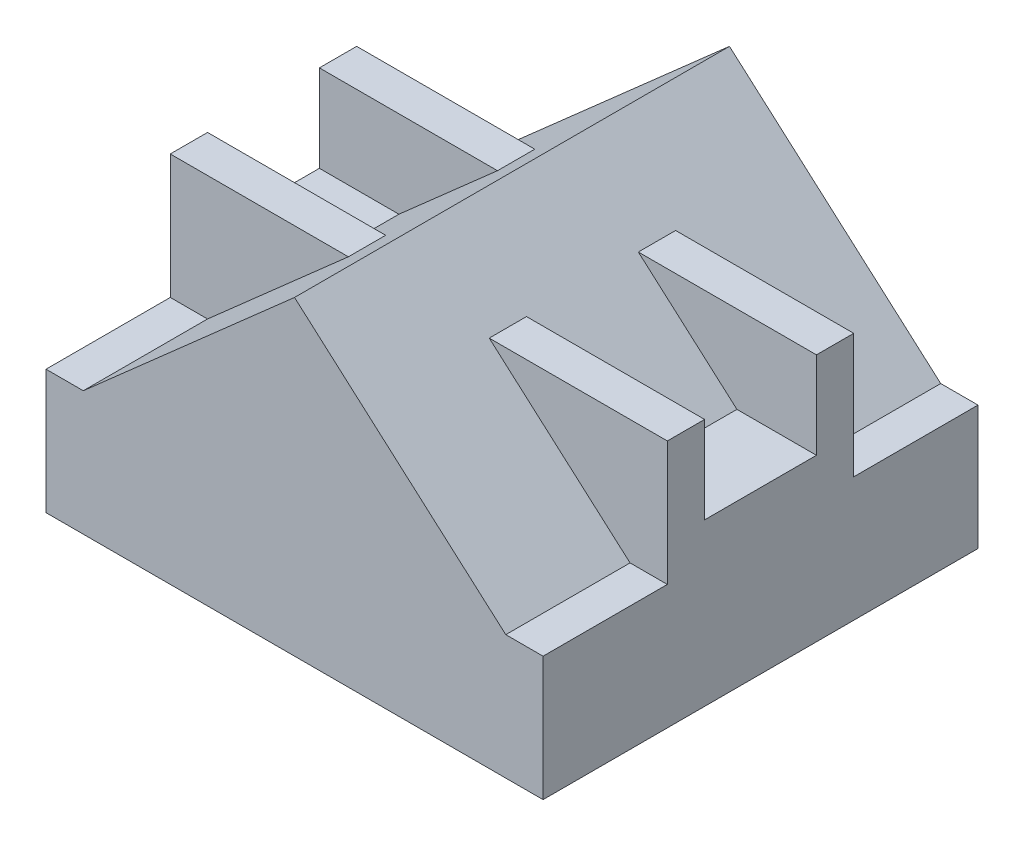
from build123d import *

# Parameters (mm, degrees)
SKETCH1_W           = 30
SKETCH1_H           = 45
SKETCH1_W_2         = 15
SKETCH1_H_2         = 50
BOSS_EXTRUDE3_DEPTH = 50
BOSS_EXTRUDE4_DEPTH = 175
BOSS_EXTRUDE6_DEPTH = 100


with BuildPart() as part:
    # Sketch1 → Boss-Extrude3 (new body)
    with BuildSketch(Plane(origin=(0, 0, 0), x_dir=(1, 0, 0), z_dir=(0, 1, 0))):
        Polygon((85, 87.5), (-85, 87.5), (-85, 37.5), (-70, 37.5), (-35, 37.5), (-35, 22.5), (-70, 22.5), (-70, -22.5), (-35, -22.5), (-35, -37.5), (-85, -37.5), (-85, -87.5), (85, -87.5), (85, -37.5), (35, -37.5), (35, -22.5), (70, -22.5), (70, 22.5), (35, 22.5), (35, 37.5), (70, 37.5), (85, 37.5), align=None)
        with Locations((-85, 0)):
            Rectangle(SKETCH1_W, SKETCH1_H)
        with Locations((-92.5, 62.5)):
            Rectangle(SKETCH1_W_2, SKETCH1_H_2)
        Polygon((-85, 37.5), (-100, 37.5), (-100, 22.5), (-70, 22.5), (-35, 22.5), (-35, 37.5), (-70, 37.5), align=None)
        Polygon((-70, -22.5), (-100, -22.5), (-100, -37.5), (-85, -37.5), (-35, -37.5), (-35, -22.5), align=None)
        with Locations((-92.5, -62.5)):
            Rectangle(SKETCH1_W_2, SKETCH1_H_2)
        with Locations((92.5, 62.5)):
            Rectangle(SKETCH1_W_2, SKETCH1_H_2)
        Polygon((100, 37.5), (85, 37.5), (70, 37.5), (35, 37.5), (35, 22.5), (70, 22.5), (100, 22.5), align=None)
        with Locations((85, 0)):
            Rectangle(SKETCH1_W, SKETCH1_H)
        Polygon((100, -37.5), (100, -22.5), (70, -22.5), (35, -22.5), (35, -37.5), (85, -37.5), align=None)
        with Locations((92.5, -62.5)):
            Rectangle(SKETCH1_W_2, SKETCH1_H_2)
    extrude(amount=BOSS_EXTRUDE3_DEPTH)

    # Sketch5 → Boss-Extrude4 (add)
    with BuildSketch(Plane.XY.offset(87.5)):
        Polygon((-100, 50), (-85, 50), (0, 125), (85, 50), (100, 50), (100, 0), (-100, 0), align=None)
    extrude(amount=-BOSS_EXTRUDE4_DEPTH)

    # Sketch18 → Boss-Extrude6 (add, symmetric)
    with BuildSketch(Plane(origin=(0, 0, 0), x_dir=(0, 0, -1), z_dir=(1, 0, 0))):
        Polygon((-87.5, 50), (-37.5, 50), (-37.5, 100), (-22.5, 100), (-22.5, 65), (22.5, 65), (22.5, 100), (37.5, 100), (37.5, 50), (87.5, 50), (87.5, 0), (-87.5, 0), align=None)
    extrude(amount=BOSS_EXTRUDE6_DEPTH, both=True)


solid = part.part
